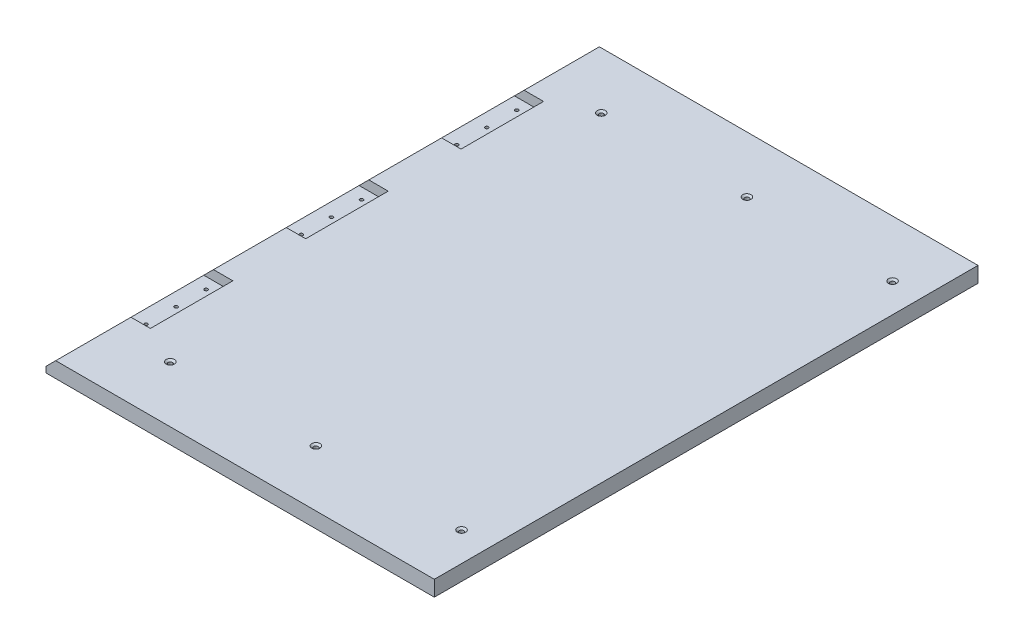
from build123d import *

# Parameters (mm, degrees)
SKETCH1_W                                         = 400
SKETCH1_H                                         = 560
BOSS_EXTRUDE1_DEPTH                               = 16
SKETCH2_W                                         = 30
SKETCH2_H                                         = 85
CUT_EXTRUDE1_DEPTH                                = 10
CHAMFER2_SIZE                                     = 10
F_8_36_TAPPED_HOLE1_AT_2_COUNT                    = 2
F_8_36_TAPPED_HOLE1_AT_2_PITCH                    = 31
F_8_36_TAPPED_HOLE1_AT_3_COUNT                    = 2
F_8_36_TAPPED_HOLE1_AT_3_PITCH                    = 62
LPATTERN1_COUNT                                   = 3
LPATTERN1_PITCH                                   = 160
CSK_FOR_8_FLAT_HEAD_MACHINE_SCREW_100_D           = 4.4958
CSK_FOR_8_FLAT_HEAD_MACHINE_SCREW_100_CSINK_D     = 8.4328
CSK_FOR_8_FLAT_HEAD_MACHINE_SCREW_100_CSINK_ANGLE = 100


with BuildPart() as part:
    # Sketch1 → Boss-Extrude1 (new body)
    with BuildSketch(Plane(origin=(0, 0, 0), x_dir=(1, 0, 0), z_dir=(0, 1, 0))):
        Rectangle(SKETCH1_W, SKETCH1_H)
    extrude(amount=BOSS_EXTRUDE1_DEPTH)

    # Sketch2 → Cut-Extrude1 (cut)
    with BuildSketch(Plane(origin=(0, 16, 0), x_dir=(1, 0, 0), z_dir=(0, 1, 0))):
        with Locations((-185, 160)):
            Rectangle(SKETCH2_W, SKETCH2_H)
        with Locations((-185, 0)):
            Rectangle(SKETCH2_W, SKETCH2_H)
        with Locations((-185, -160)):
            Rectangle(SKETCH2_W, SKETCH2_H)
    extrude(amount=-CUT_EXTRUDE1_DEPTH, mode=Mode.SUBTRACT)

    # Chamfer2
    chamfer2_edges = [part.edges().sort_by_distance(p)[0] for p in [
        (-200, 16, -241.25),
        (-200, 16, -80),
        (-200, 16, 80),
        (-200, 16, 241.25),
    ]]
    chamfer(chamfer2_edges, length=CHAMFER2_SIZE)

    # Sketch7 → #8-36 Tapped Hole1 (revolve, cut)
    with BuildSketch(Plane(origin=(-186, 6, 129), x_dir=(0, 0, 1), z_dir=(1, 0, 0))):
        Polygon((0, 0), (0, 26.037806461), (1.7272, 25), (1.7272, 0), align=None)
    f_8_36_tapped_hole1 = revolve(axis=Axis((-186, 12.35, 129), (0, -1, 0)), mode=Mode.SUBTRACT)

    # #8-36 Tapped Hole1 at 2: #8-36 Tapped Hole1 ×2
    with Locations(*[(0, 0, i * F_8_36_TAPPED_HOLE1_AT_2_PITCH) for i in range(1, F_8_36_TAPPED_HOLE1_AT_2_COUNT)]):
        add(f_8_36_tapped_hole1, mode=Mode.SUBTRACT)

    # #8-36 Tapped Hole1 at 3: #8-36 Tapped Hole1 ×2
    with Locations(*[(0, 0, i * F_8_36_TAPPED_HOLE1_AT_3_PITCH) for i in range(1, F_8_36_TAPPED_HOLE1_AT_3_COUNT)]):
        add(f_8_36_tapped_hole1, mode=Mode.SUBTRACT)

    # LPattern1: #8-36 Tapped Hole1 ×3
    with Locations(*[(0, 0, -i * LPATTERN1_PITCH) for i in range(1, LPATTERN1_COUNT)]):
        add(f_8_36_tapped_hole1, mode=Mode.SUBTRACT)

    # LPattern1 copy 1 sketch → LPattern1 copy 1 (revolve, cut)
    with BuildSketch(Plane(origin=(-186, 6, 0), x_dir=(0, 0, 1), z_dir=(1, 0, 0))):
        Polygon((0, 0), (0, 26.037806461), (1.7272, 25), (1.7272, 0), align=None)
    revolve(axis=Axis((-186, 12.35, 0), (0, -1, 0)), mode=Mode.SUBTRACT)

    # LPattern1 copy 2 sketch → LPattern1 copy 2 (revolve, cut)
    with BuildSketch(Plane(origin=(-186, 6, -160), x_dir=(0, 0, 1), z_dir=(1, 0, 0))):
        Polygon((0, 0), (0, 26.037806461), (1.7272, 25), (1.7272, 0), align=None)
    revolve(axis=Axis((-186, 12.35, -160), (0, -1, 0)), mode=Mode.SUBTRACT)

    # LPattern1 copy 3 sketch → LPattern1 copy 3 (revolve, cut)
    with BuildSketch(Plane(origin=(-186, 6, 31), x_dir=(0, 0, 1), z_dir=(1, 0, 0))):
        Polygon((0, 0), (0, 26.037806461), (1.7272, 25), (1.7272, 0), align=None)
    revolve(axis=Axis((-186, 12.35, 31), (0, -1, 0)), mode=Mode.SUBTRACT)

    # LPattern1 copy 4 sketch → LPattern1 copy 4 (revolve, cut)
    with BuildSketch(Plane(origin=(-186, 6, -129), x_dir=(0, 0, 1), z_dir=(1, 0, 0))):
        Polygon((0, 0), (0, 26.037806461), (1.7272, 25), (1.7272, 0), align=None)
    revolve(axis=Axis((-186, 12.35, -129), (0, -1, 0)), mode=Mode.SUBTRACT)

    # CSK for #8 Flat Head Machine Screw (100)1 (through all)
    with Locations(Plane(origin=(617.704940286, 16, 0), x_dir=(1, 0, 0), z_dir=(0, 1, 0))):
        with Locations((-447.704940286, -222), (-597.704940286, -222), (-747.704940286, -222)):
            csk_for_8_flat_head_machine_screw_100 = CounterSinkHole(CSK_FOR_8_FLAT_HEAD_MACHINE_SCREW_100_D / 2, CSK_FOR_8_FLAT_HEAD_MACHINE_SCREW_100_CSINK_D / 2, counter_sink_angle=CSK_FOR_8_FLAT_HEAD_MACHINE_SCREW_100_CSINK_ANGLE)

    # Mirror1: CSK for #8 Flat Head Machine Screw (100)1 across plane
    add(csk_for_8_flat_head_machine_screw_100.mirror(Plane.XY), mode=Mode.SUBTRACT)


solid = part.part
